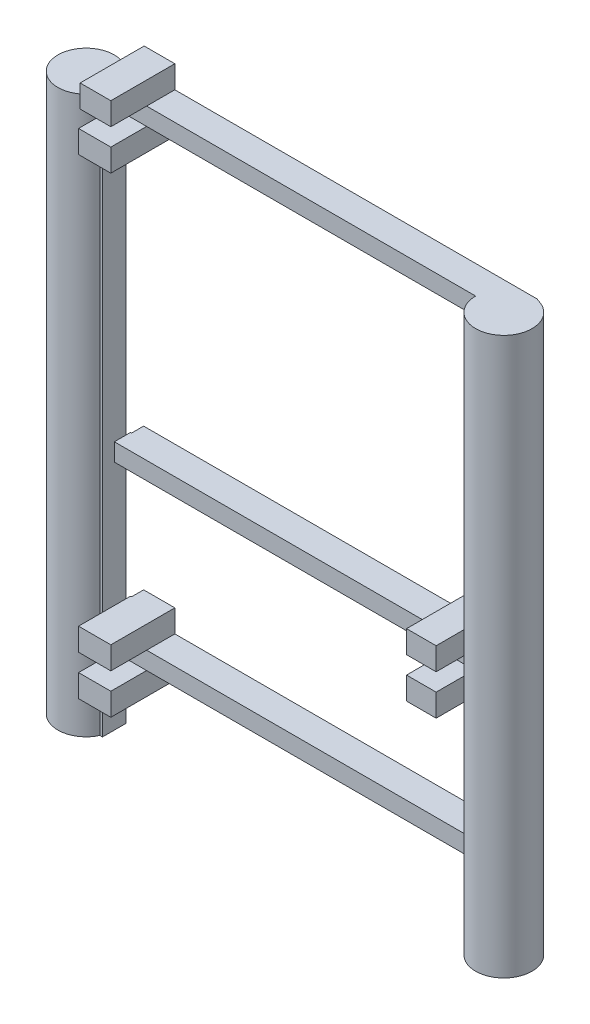
from build123d import *

# Parameters (mm, degrees)
SKETCH2_R             = 2.5
BOSS_EXTRUDE1_DEPTH   = 49.3
BOSS_EXTRUDE1_2_DEPTH = 49.3
BOSS_EXTRUDE2_DEPTH   = 49.3
SKETCH4_W             = 2.5
SKETCH4_H             = 1.56
BOSS_EXTRUDE4_DEPTH   = 35
BOSS_EXTRUDE8_DEPTH   = 2
SKETCH15_W            = 2.621045261
SKETCH15_H            = 5.894157502
BOSS_EXTRUDE10_DEPTH  = 2
SKETCH16_W            = 2.858555501
SKETCH16_H            = 5.670918984
BOSS_EXTRUDE11_DEPTH  = 2
SKETCH17_W            = 2.858555501
SKETCH17_H            = 5.670918984
BOSS_EXTRUDE12_DEPTH  = 2
BOSS_EXTRUDE13_DEPTH  = 2
SKETCH21_W            = 2.718681831
SKETCH21_H            = 5.670918984
BOSS_EXTRUDE16_DEPTH  = 2
SKETCH22_W            = 0.232218322
SKETCH22_H            = 1.447780317
CUT_EXTRUDE3_DEPTH    = 49.4


with BuildPart() as part:
    # Sketch2 → Boss-Extrude1 (new body)
    with BuildSketch(Plane(origin=(0, 0, 0), x_dir=(1, 0, 0), z_dir=(0, 1, 0))):
        with Locations(Location((0, 0, 0), (0, 0, 270))):
            Circle(SKETCH2_R)
    extrude(amount=BOSS_EXTRUDE1_DEPTH)

    # Sketch3 → Boss-Extrude2 (add)
    with BuildSketch(Plane(origin=(0, 0, 0), x_dir=(1, 0, 0), z_dir=(0, 1, 0))):
        with BuildLine():
            Line((2.5, 0), (2.499588142, -0.045377544))
            ThreePointArc((2.499588142, -0.045377544), (2.436264871, -0.560904161), (2.267781678, -1.052219683))
            Line((2.267781678, -1.052219683), (2.267781678, -2.5))
            Line((2.267781678, -2.5), (2.5, -2.5))
            Line((2.5, -2.5), (2.5, 0))
        make_face()
        with BuildLine():
            ThreePointArc((2.267781678, 1.052219683), (2.44125523, 0.538769805), (2.5, 0))
            Line((2.5, 0), (2.5, 2.5))
            Line((2.5, 2.5), (2.267781678, 2.5))
            Line((2.267781678, 2.5), (2.267781678, 1.052219683))
        make_face()
    extrude(amount=BOSS_EXTRUDE2_DEPTH)



with BuildPart() as body_2:
    # Sketch2 → Boss-Extrude1 2 (new body)
    with BuildSketch(Plane(origin=(0, 0, 0), x_dir=(1, 0, 0), z_dir=(0, 1, 0))):
        with Locations(Location((37, 0, 0), (0, 0, 270))):
            Circle(SKETCH2_R)
    extrude(amount=BOSS_EXTRUDE1_2_DEPTH)


with BuildPart() as part_1:
    add(part.part)

    add(body_2.part)  # Boss-Extrude4 merges body 2
    # Sketch4 → Boss-Extrude4 (add)
    with BuildSketch(Plane(origin=(2.5, 0, 0), x_dir=(0, 0, -1), z_dir=(1, 0, 0))):
        with Locations((1.25, 48.52)):
            Rectangle(SKETCH4_W, SKETCH4_H)
        with Locations((1.25, 21.34)):
            Rectangle(SKETCH4_W, SKETCH4_H)
        with Locations((1.25, 6.78)):
            Rectangle(SKETCH4_W, SKETCH4_H)
    extrude(amount=BOSS_EXTRUDE4_DEPTH)

    # Sketch10 → Boss-Extrude8 (add)
    with BuildSketch(Plane(origin=(0, 22.12, 0), x_dir=(1, 0, 0), z_dir=(0, 1, 0))):
        Polygon((31.775974476, 2.5), (31.775974476, -0.65349723), (31.775974476, -2.529631849), (31.775974476, -3.394157502), (34.397019737, -3.394157502), (34.397019737, -2.529631849), (34.397019737, -0.644583093), (34.397019737, 2.5), align=None)
    extrude(amount=BOSS_EXTRUDE8_DEPTH)

    # Sketch15 → Boss-Extrude10 (add)
    with BuildSketch(Plane.XZ.offset(-20.56)):
        with Locations((33.086497107, 0.447078751)):
            Rectangle(SKETCH15_W, SKETCH15_H)
    extrude(amount=BOSS_EXTRUDE10_DEPTH)

    # Sketch16 → Boss-Extrude11 (add)
    with BuildSketch(Plane(origin=(0, 7.56, 0), x_dir=(1, 0, 0), z_dir=(0, 1, 0))):
        with Locations((3.929277751, -0.335459492)):
            Rectangle(SKETCH16_W, SKETCH16_H)
    extrude(amount=BOSS_EXTRUDE11_DEPTH)

    # Sketch17 → Boss-Extrude12 (add)
    with BuildSketch(Plane(origin=(0, 6, 0), x_dir=(-1, 0, 0), z_dir=(0, -1, 0))):
        with Locations((-3.929277751, -0.335459492)):
            Rectangle(SKETCH17_W, SKETCH17_H)
    extrude(amount=BOSS_EXTRUDE12_DEPTH)

    # Sketch18 → Boss-Extrude13 (add)
    with BuildSketch(Plane(origin=(0, 47.74, 0), x_dir=(-1, 0, 0), z_dir=(0, -1, 0))):
        Polygon((-2.5, 2.512386099), (-5.358555501, 2.5), (-5.358555501, -3.170918984), (-2.5, -3.170918984), align=None)
    extrude(amount=BOSS_EXTRUDE13_DEPTH)

    # Sketch21 → Boss-Extrude16 (add)
    with BuildSketch(Plane(origin=(0, 49.3, 0), x_dir=(1, 0, 0), z_dir=(0, 1, 0))):
        with Locations((3.999214586, -0.335459492)):
            Rectangle(SKETCH21_W, SKETCH21_H)
    extrude(amount=BOSS_EXTRUDE16_DEPTH)

    # Sketch22 → Cut-Extrude3 (cut)
    with BuildSketch(Plane(origin=(0, 0, 0), x_dir=(1, 0, 0), z_dir=(0, 1, 0))):
        Polygon((2.267781678, 1.052219683), (2.267781678, 2.5), (2.5, 2.5), (2.593422148, 2.5), (2.593422148, 1.424983609), (2.5, 1.424983609), (2.5, 1.052219683), align=None)
        with Locations((2.383890839, -1.776109842)):
            Rectangle(SKETCH22_W, SKETCH22_H)
    extrude(amount=CUT_EXTRUDE3_DEPTH, mode=Mode.SUBTRACT)


solid = part_1.part
